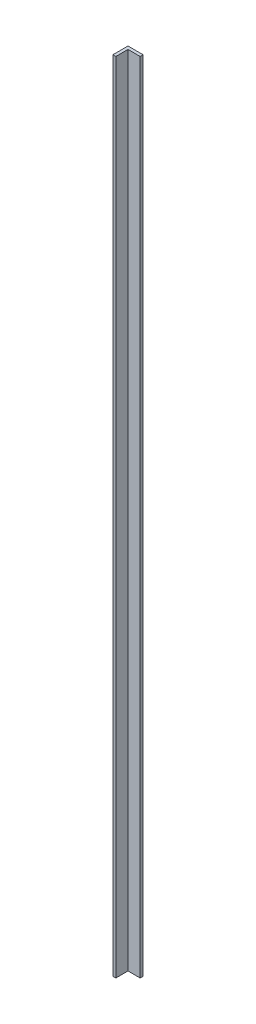
from build123d import *

# Parameters (mm, degrees)
BOSS_EXTRUDE1_DEPTH = 427.1518


with BuildPart() as part:
    # Sketch1 → Boss-Extrude1 (new body)
    with BuildSketch(Plane(origin=(0, 0, 0), x_dir=(1, 0, 0), z_dir=(0, 1, 0))):
        Polygon((0, 0), (6.5, 0), (6.5, 1.5875), (-1.5875, 1.5875), (-1.5875, -6.5), (0, -6.5), align=None)
    extrude(amount=BOSS_EXTRUDE1_DEPTH)


solid = part.part
